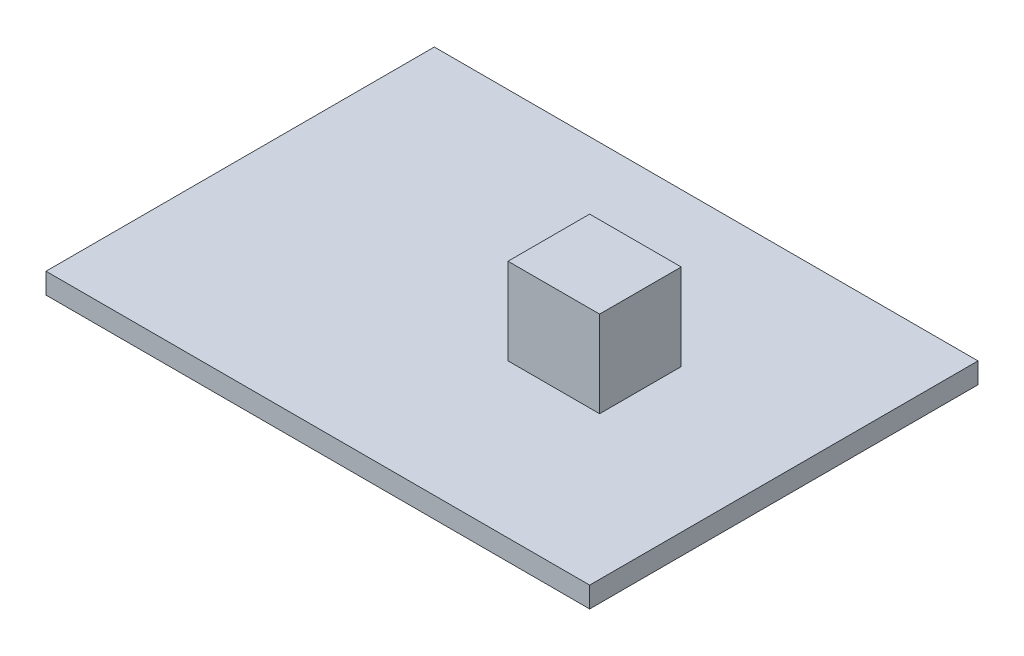
from build123d import *

# Parameters (mm, degrees)
SKETCH1_W           = 63
SKETCH1_H           = 45
BOSS_EXTRUDE1_DEPTH = 2.4
SKETCH3_W           = 10.613779313
SKETCH3_H           = 9.458952204
BOSS_EXTRUDE2_DEPTH = 10


with BuildPart() as part:
    # Sketch1 → Boss-Extrude1 (new body)
    with BuildSketch(Plane(origin=(0, 0, 0), x_dir=(1, 0, 0), z_dir=(0, 1, 0))):
        with Locations((-4.421311475, 0.5)):
            Rectangle(SKETCH1_W, SKETCH1_H)
    extrude(amount=BOSS_EXTRUDE1_DEPTH)

    # Sketch3 → Boss-Extrude2 (add)
    with BuildSketch(Plane(origin=(0, 2.4, 0), x_dir=(1, 0, 0), z_dir=(0, 1, 0))):
        with Locations((5.152841445, 0.5)):
            Rectangle(SKETCH3_W, SKETCH3_H)
    extrude(amount=BOSS_EXTRUDE2_DEPTH)


solid = part.part
